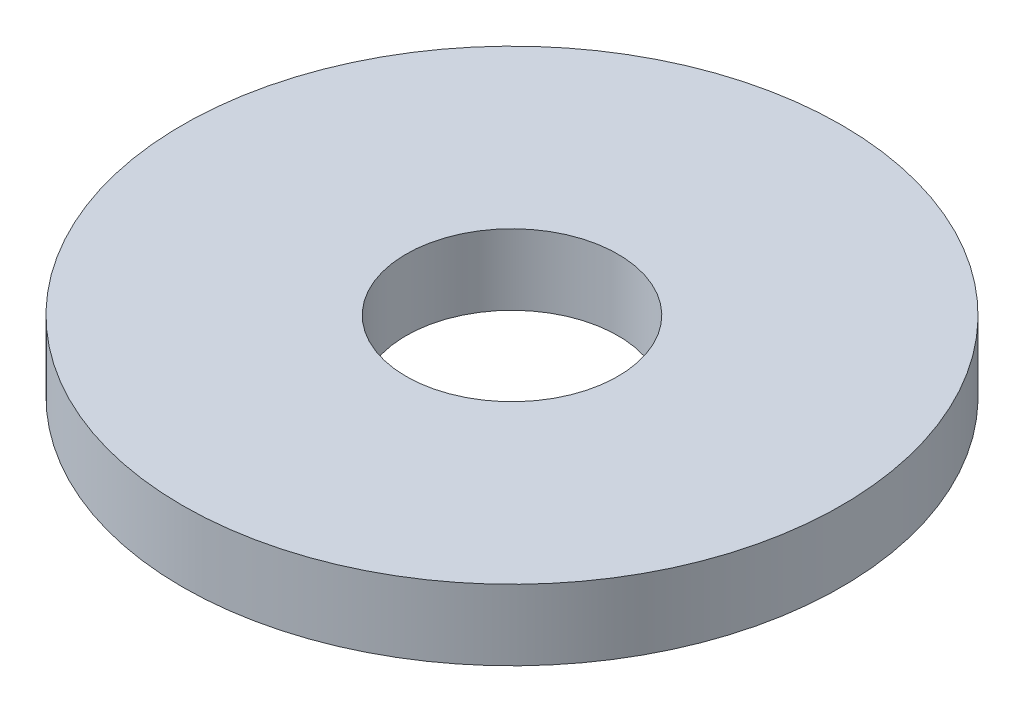
from build123d import *

# Parameters (mm, degrees)
SKETCH1_R          = 14
BASE_EXTRUDE_DEPTH = 3
SKETCH2_R          = 4.5
TYPE_R_DEPTH       = 21.024984395


with BuildPart() as part:
    # Sketch1 → Base-Extrude (new body)
    with BuildSketch(Plane(origin=(0, 0, 0), x_dir=(1, 0, 0), z_dir=(0, 1, 0))):
        with Locations(Location((0, 0, 0), (0, 0, 270))):
            Circle(SKETCH1_R)
    extrude(amount=-BASE_EXTRUDE_DEPTH)

    # Sketch2 → Type-R (cut, through all)
    with BuildSketch(Plane(origin=(0, 0, 0), x_dir=(-1, 0, 0), z_dir=(0, 1, 0))):
        with Locations(Location((0, 0, 0), (0, 0, 90))):
            Circle(SKETCH2_R)
    extrude(amount=-TYPE_R_DEPTH, mode=Mode.SUBTRACT)


solid = part.part
